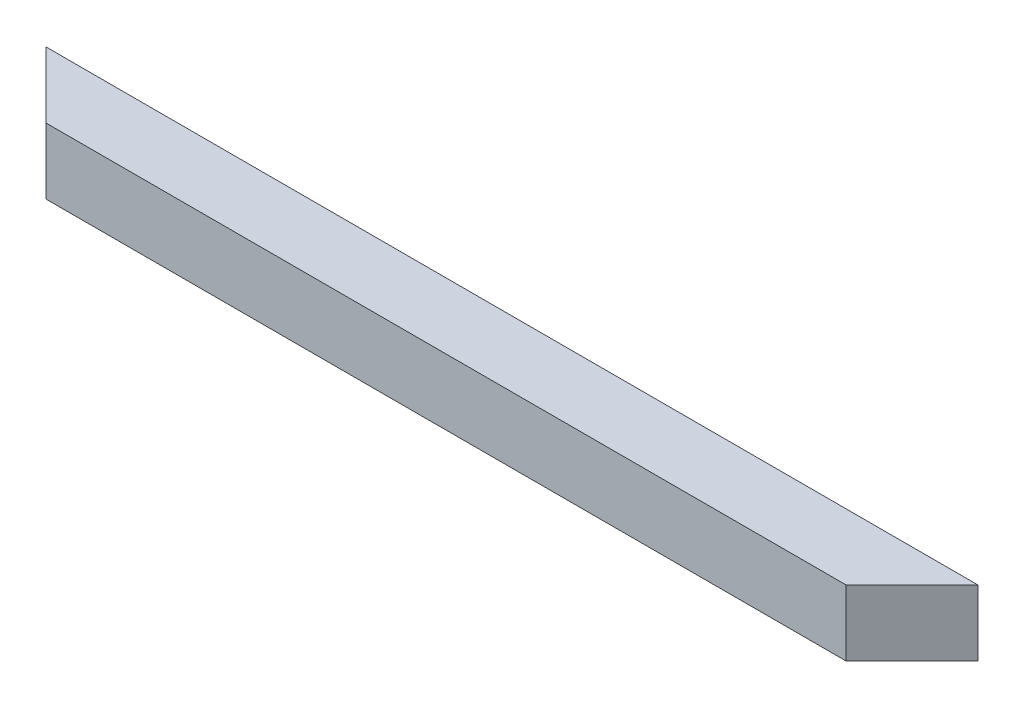
from build123d import *

# Parameters (mm, degrees)
BOSS_EXTRUDE1_DEPTH = 25.4


with BuildPart() as part:
    # Sketch2 → Boss-Extrude1 (new body)
    with BuildSketch(Plane(origin=(0, 0, 0), x_dir=(1, 0, 0), z_dir=(0, 1, 0))):
        Polygon((179.605051, 12.7), (154.205051, -12.7), (-154.205051, -12.7), (-179.605051, 12.7), align=None)
    extrude(amount=BOSS_EXTRUDE1_DEPTH)


solid = part.part
